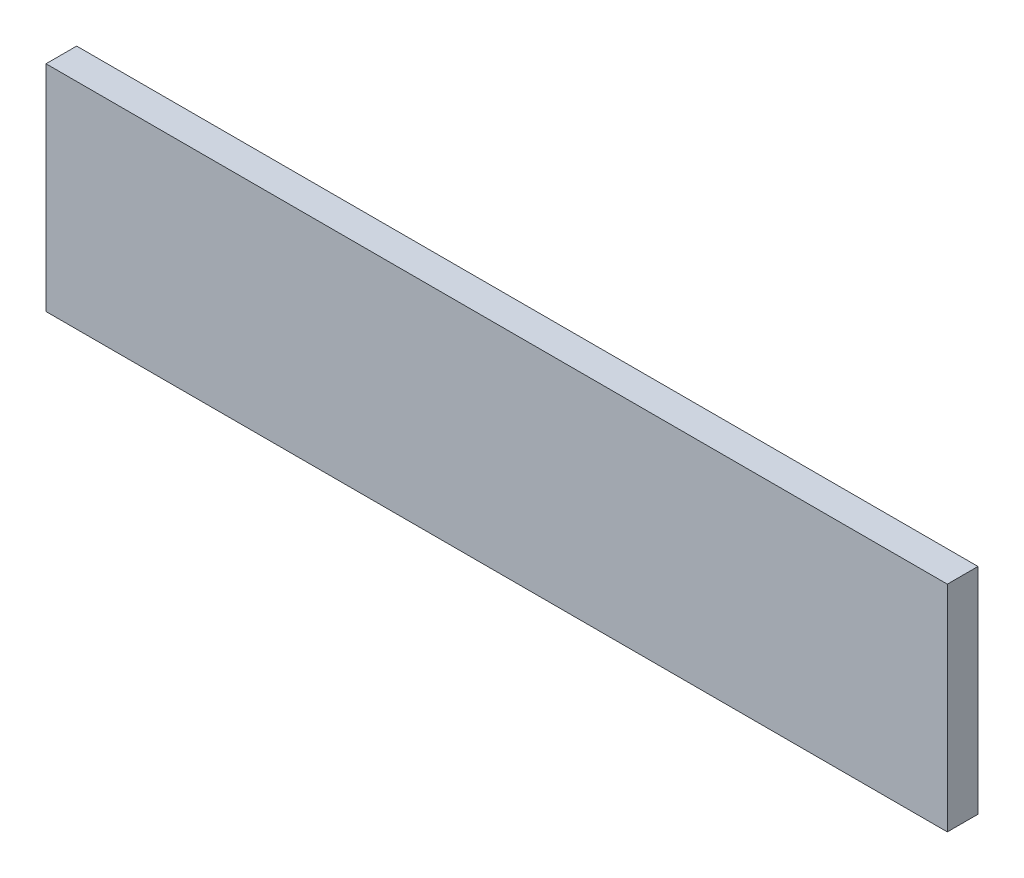
from build123d import *

# Parameters (mm, degrees)
SKETCH1_W           = 294
SKETCH1_H           = 70
BOSS_EXTRUDE1_DEPTH = 10


with BuildPart() as part:
    # Sketch1 → Boss-Extrude1 (new body)
    with BuildSketch(Plane.XY):
        with Locations((100, 28)):
            Rectangle(SKETCH1_W, SKETCH1_H)
    extrude(amount=BOSS_EXTRUDE1_DEPTH)


solid = part.part
